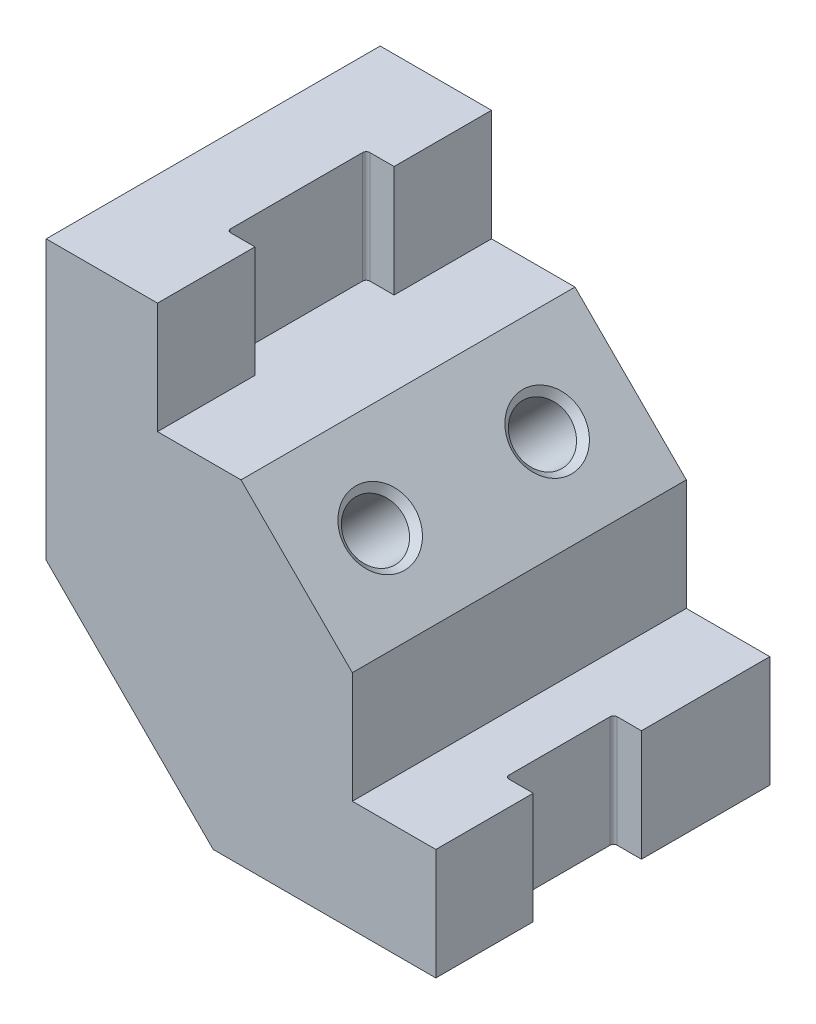
from build123d import *

# Parameters (mm, degrees)
BOSS_EXTRUDE1_DEPTH     = 38.1
CUT_EXTRUDE1_DEPTH      = 142.777171117
CUT_EXTRUDE1_DEPTH_BACK = 142.777171117
SKETCH2_R               = 6.35
SKETCH3_W               = 6.35
SKETCH3_H               = 31.75
CUT_EXTRUDE2_DEPTH      = 25.4
SKETCH4_W               = 6.35
SKETCH4_H               = 24.683418283
CUT_EXTRUDE3_DEPTH      = 124.131068378
FILLET1_R               = 0.8128
CHAMFER1_SIZE           = 1.524


with BuildPart() as part:
    # Sketch1 → Boss-Extrude1 (new, symmetric)
    with BuildSketch(Plane.XY):
        Polygon((88.9, -101.6), (88.9, -76.2), (69.85, -76.2), (69.85, -50.8), (44.45, -25.4), (25.4, -25.4), (25.4, 0), (0, 0), (0, -63.5), (38.1, -101.6), align=None)
    extrude(amount=BOSS_EXTRUDE1_DEPTH, both=True)

    # Sketch2 → Cut-Extrude1 (cut, two sides: drawn at the far end of the back side and taken through both)
    with BuildSketch(Plane(origin=(9.525, 9.525, 0), x_dir=(0, 0, -1), z_dir=(0.7071067811865485, 0.7071067811865466, 0)).offset(-CUT_EXTRUDE1_DEPTH_BACK)):
        with Locations(Location((19.05, -67.35463315, 0), (0, 0, 90))):
            Circle(SKETCH2_R)
        with Locations(Location((-19.05, -67.35463315, 0), (0, 0, 90))):
            Circle(SKETCH2_R)
    extrude(amount=CUT_EXTRUDE1_DEPTH + CUT_EXTRUDE1_DEPTH_BACK, mode=Mode.SUBTRACT)

    # Sketch3 → Cut-Extrude2 (cut)
    with BuildSketch(Plane(origin=(0, 0, 0), x_dir=(1, 0, 0), z_dir=(0, 1, 0))):
        with Locations((22.225, 0)):
            Rectangle(SKETCH3_W, SKETCH3_H)
    extrude(amount=-CUT_EXTRUDE2_DEPTH, mode=Mode.SUBTRACT)

    # Sketch4 → Cut-Extrude3 (cut, through all)
    with BuildSketch(Plane(origin=(0, -76.2, 0), x_dir=(1, 0, 0), z_dir=(0, 1, 0))):
        with Locations((85.725, -3.533290859)):
            Rectangle(SKETCH4_W, SKETCH4_H)
    extrude(amount=-CUT_EXTRUDE3_DEPTH, mode=Mode.SUBTRACT)

    # Fillet1
    fillet1_edges = [part.edges().sort_by_distance(p)[0] for p in [
        (19.05, -12.7, 15.875),
        (19.05, -12.7, -15.875),
        (82.55, -88.9, 15.875),
        (82.55, -88.9, -8.808418283),
    ]]
    fillet(fillet1_edges, radius=FILLET1_R)

    # Chamfer1
    chamfer1_edges = [part.edges().sort_by_distance(p)[0] for p in [
        (61.642045905, -42.592045905, -19.05),
        (20.367045905, -83.867045905, -19.05),
        (61.642045905, -42.592045905, 19.05),
        (20.367045905, -83.867045905, 19.05),
    ]]
    chamfer(chamfer1_edges, length=CHAMFER1_SIZE)


solid = part.part
